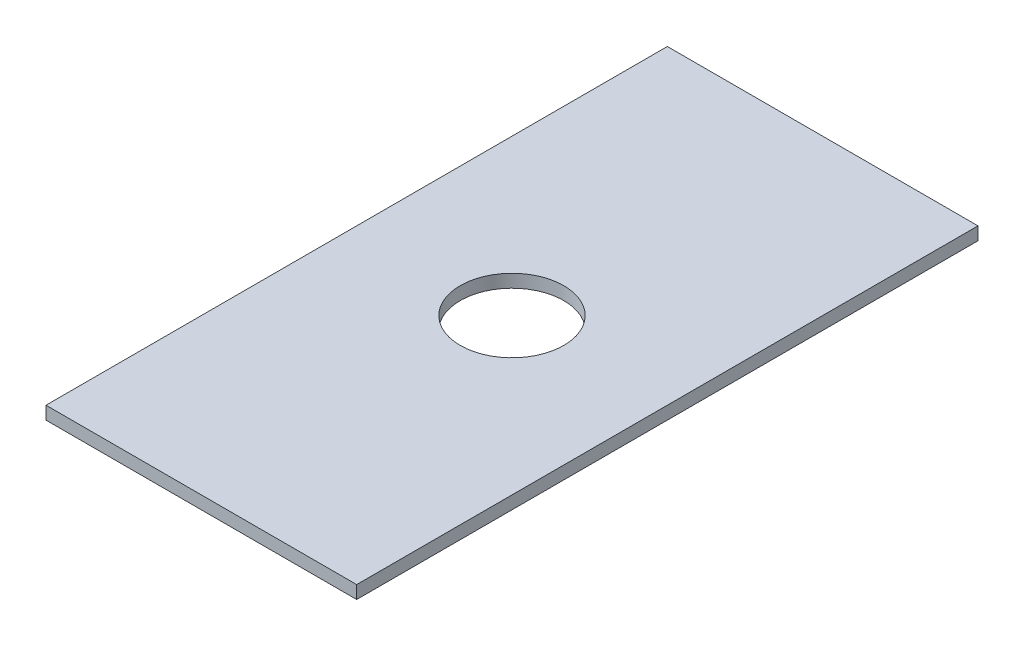
from build123d import *

# Parameters (mm, degrees)
SKETCH1_W           = 76.2
SKETCH1_H           = 152.4
SKETCH1_R           = 12.7
BOSS_EXTRUDE1_DEPTH = 3.175


with BuildPart() as part:
    # Sketch1 → Boss-Extrude1 (new body)
    with BuildSketch(Plane(origin=(0, 0, 0), x_dir=(1, 0, 0), z_dir=(0, 1, 0))):
        Rectangle(SKETCH1_W, SKETCH1_H)
        with Locations(Location((0, 0, 0), (0, 0, 270))):
            Circle(SKETCH1_R, mode=Mode.SUBTRACT)
    extrude(amount=BOSS_EXTRUDE1_DEPTH)


solid = part.part
